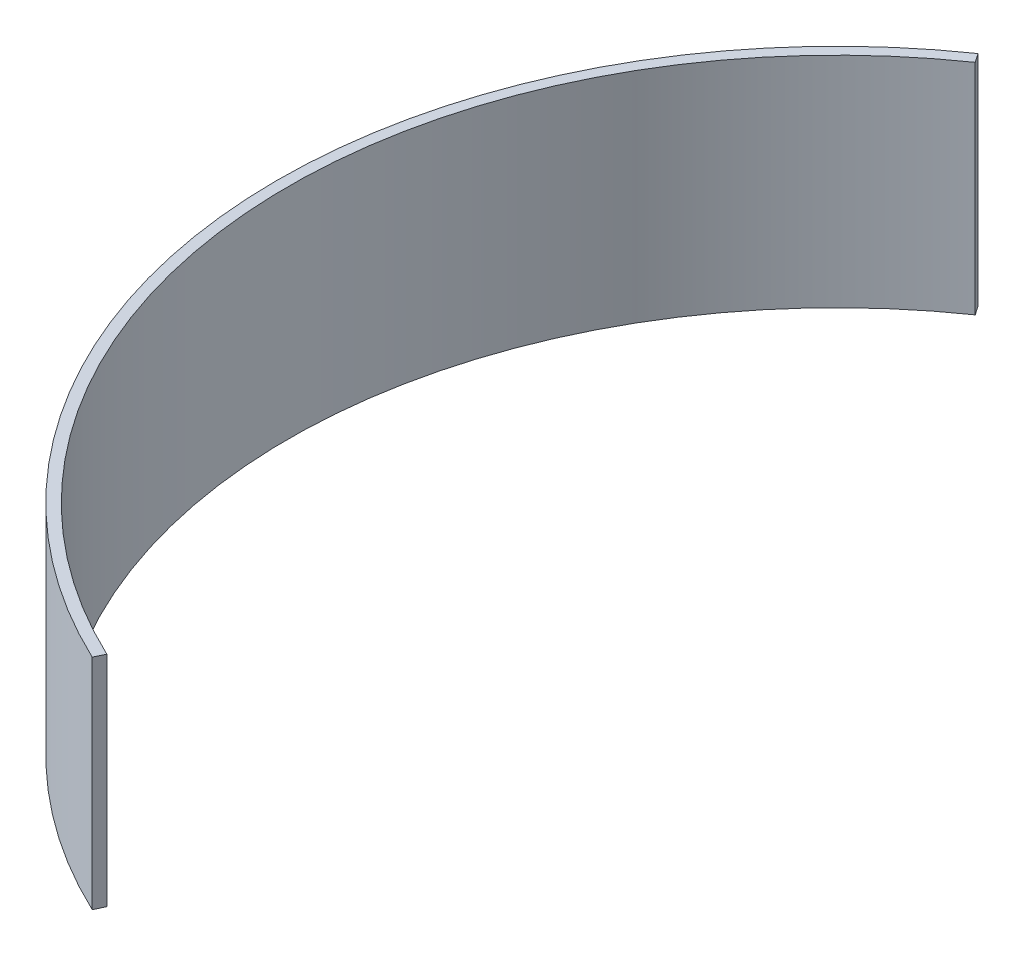
from build123d import *

# Parameters (mm, degrees)
BOSS_EXTRUDE1_DEPTH = 40


with BuildPart() as part:
    # Sketch2 → Boss-Extrude1 (new body)
    with BuildSketch(Plane(origin=(0, 0, 0), x_dir=(1, 0, 0), z_dir=(0, 1, 0))):
        with BuildLine():
            Line((-58.280619845, 84.081403268), (-57.141269474, 82.437663406))
            ThreePointArc((-57.141269474, 82.437663406), (-99.963745476, -8.266959266), (-42.822476002, -90.704622672))
            Line((-42.822476002, -90.704622672), (-43.676321293, -92.513198968))
            ThreePointArc((-43.676321293, -92.513198968), (-101.956941138, -8.4317957), (-58.280619845, 84.081403268))
        make_face()
    extrude(amount=BOSS_EXTRUDE1_DEPTH)


solid = part.part
